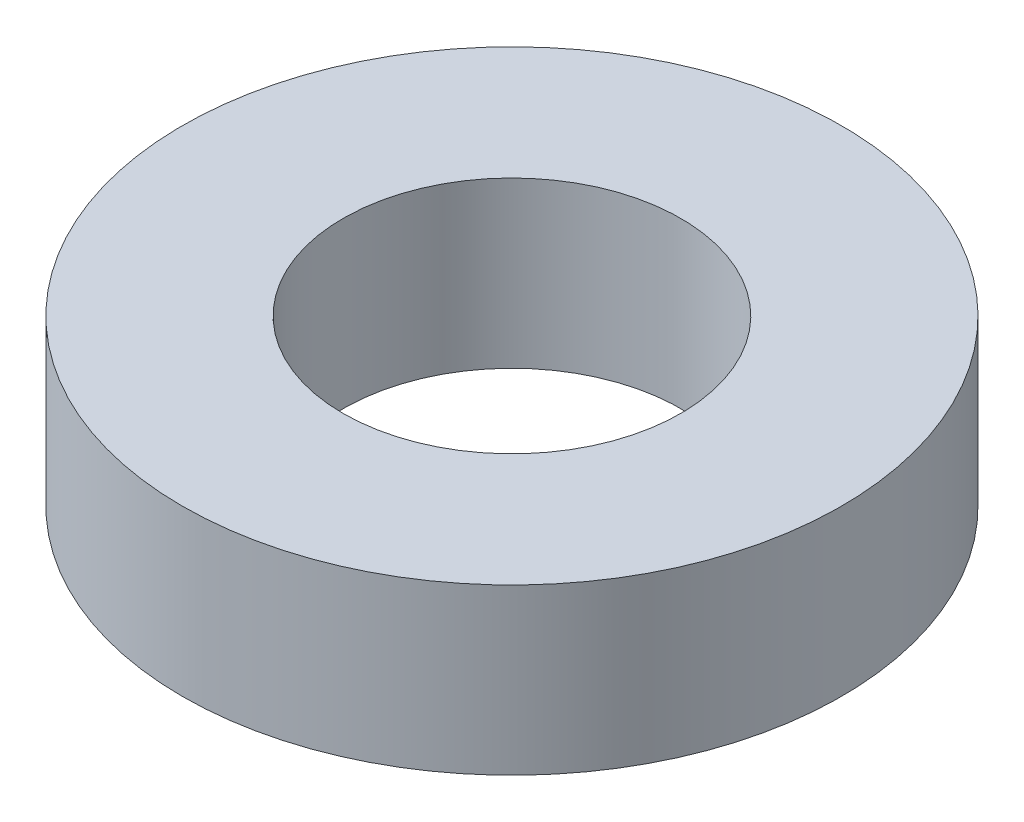
from build123d import *

# Parameters (mm, degrees)
SKETCH_1_R      = 8
SKETCH_1_R_2    = 4.1
EXTRUDE_1_DEPTH = 4


with BuildPart() as part:
    # Эскиз1 → Бобышка-Вытянуть1 (new body)
    with BuildSketch(Plane(origin=(0, 0, 0), x_dir=(1, 0, 0), z_dir=(0, 1, 0))):
        with Locations(Location((0, 0, 0), (0, 0, 270))):
            Circle(SKETCH_1_R)
        with Locations(Location((0, 0, 0), (0, 0, 270))):
            Circle(SKETCH_1_R_2, mode=Mode.SUBTRACT)
    extrude(amount=EXTRUDE_1_DEPTH)


solid = part.part
